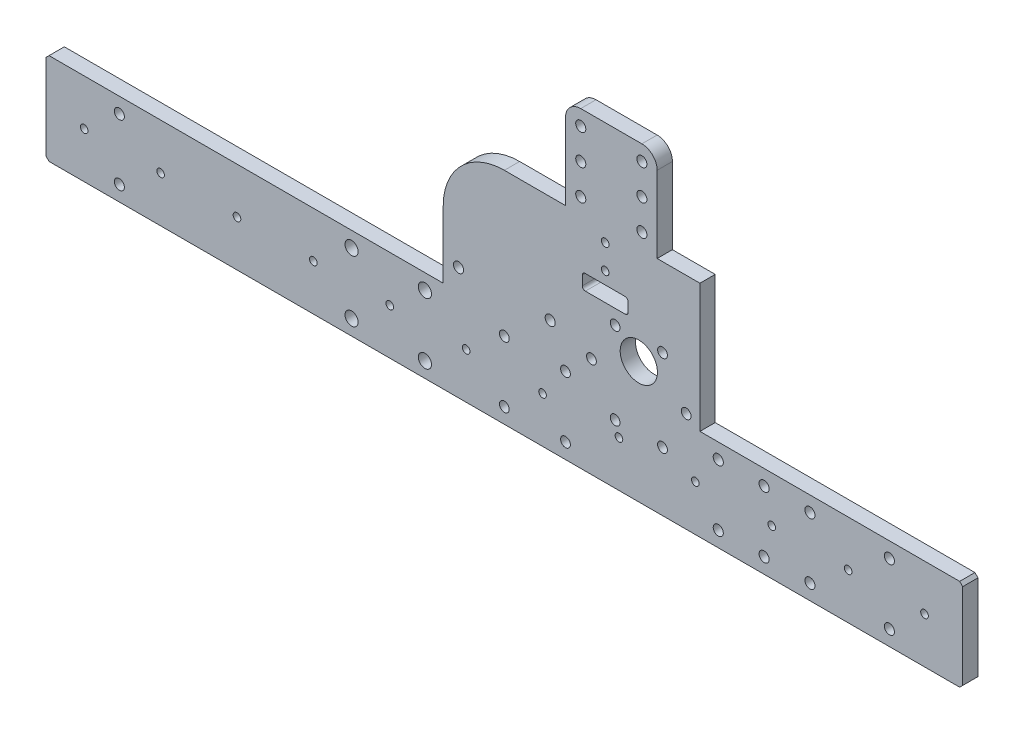
from build123d import *

# Parameters (mm, degrees)
SKETCH_1_W                  = 300
SKETCH_1_H                  = 30
EXTRUDE_1_DEPTH             = 5
CHAMFER_1_SIZE              = 1
HOLE_WIZARD_M3_1_D          = 3.2
M3X0_5_1_D                  = 2.5
M4X0_7_1_D                  = 3.3
M4X0_7_2_D                  = 3.3
PATTERN_LINEAR_1_COUNT      = 6
PATTERN_LINEAR_1_PITCH      = 25
PATTERN_LINEAR_1_COL_COUNT  = 7
PATTERN_LINEAR_1_COL_PITCH  = 25
EXTRUDE_3_DEPTH             = 5
SKETCH_13_R                 = 6.1
CUT_EXTRUDE_2_DEPTH         = 161.542829177
HOLE_WIZARD_M2_1_D          = 2.2
M4X0_7_3_D                  = 3.3
HOLE_WIZARD_M4_1_D          = 4.3
M3X0_5_2_D                  = 2.5
CUT_EXTRUDE_3_DEPTH         = 161.542829177
CUT_EXTRUDE_3_DEPTH_BACK    = 161.542829177
SKETCH_25_W                 = 15
SKETCH_25_H                 = 5
FILLET_1_R                  = 1
SKETCH_26_W                 = 30
SKETCH_26_H                 = 5
EXTRUDE_4_DEPTH             = 30
SKETCH_27_R                 = 1.65
CUT_EXTRUDE_4_DEPTH         = 174.476223155
PATTERN_LINEAR_2_COUNT      = 2
PATTERN_LINEAR_2_PITCH      = 20
PATTERN_LINEAR_2_COUNT_DIR2 = 3
PATTERN_LINEAR_2_PITCH_DIR2 = 10
FILLET_2_R                  = 5
HOLE_WIZARD_M3_2_D          = 3.2


with BuildPart() as part:
    # 草圖1 → 填料-伸長1 (new body)
    with BuildSketch(Plane.XY):
        Rectangle(SKETCH_1_W, SKETCH_1_H)
    extrude(amount=EXTRUDE_1_DEPTH)

    # 導角1
    chamfer_1_edges = [part.edges().sort_by_distance(p)[0] for p in [
        (150, -15, 2.5),
        (-150, -15, 2.5),
        (-150, 15, 2.5),
        (150, 15, 2.5),
    ]]
    chamfer(chamfer_1_edges, length=CHAMFER_1_SIZE)

    # M3 餘隙孔1 (through all)
    with Locations(Plane.XY.offset(5)):
        with Locations((20, -10), (20, 10), (0, -10), (0, 10)):
            Hole(HOLE_WIZARD_M3_1_D / 2)

    # M3x0.5 螺紋孔1 (through all)
    with Locations(Plane.XY.offset(5)):
        with Locations((-12.5, 0)):
            m3x0_5_1 = Hole(M3X0_5_1_D / 2)

    # M4x0.7 螺紋孔1 (through all)
    with Locations(Plane.XY.offset(5)):
        with Locations((100, 10), (70, -10), (70, 10), (100, -10), (85, 10), (85, -10)):
            Hole(M4X0_7_1_D / 2)

    # M4x0.7 螺紋孔2 (through all)
    with Locations(Plane.XY.offset(5)):
        with Locations((-126, 10), (-126, -10)):
            m4x0_7_2 = Hole(M4X0_7_2_D / 2)

    # 直線複製排列1: M3x0.5 螺紋孔1 ×6
    with Locations(*[(-i * PATTERN_LINEAR_1_PITCH, 0, 0) for i in range(1, PATTERN_LINEAR_1_COUNT)]):
        add(m3x0_5_1, mode=Mode.SUBTRACT)

    # 直線複製排列1 col: M3x0.5 螺紋孔1 ×7
    with Locations(*[(i * PATTERN_LINEAR_1_COL_PITCH, 0, 0) for i in range(1, PATTERN_LINEAR_1_COL_COUNT)]):
        add(m3x0_5_1, mode=Mode.SUBTRACT)

    # 鏡射1: M4x0.7 螺紋孔2 across plane
    add(m4x0_7_2.mirror(Plane(origin=(0, 0, 0), x_dir=(0, 0, 1), z_dir=(1, 0, 0))), mode=Mode.SUBTRACT)

    # 草圖16 → 填料-伸長3 (add, through all)
    with BuildSketch(Plane.XY):
        with BuildLine():
            Line((-20, 15), (64, 15))
            Line((64, 15), (64, 57))
            Line((64, 57), (0, 57))
            ThreePointArc((0, 57), (-14.142135624, 51.142135624), (-20, 37))
            Line((-20, 37), (-20, 15))
        make_face()
    extrude(amount=EXTRUDE_3_DEPTH)

    # 草圖13 → 除料-伸長2 (cut, through all)
    with BuildSketch(Plane.XY):
        with Locations(Location((44, 24.8, 0), (0, 0, 180))):
            Circle(SKETCH_13_R)
    extrude(amount=CUT_EXTRUDE_2_DEPTH, mode=Mode.SUBTRACT)

    # M2 餘隙孔1 (through all)
    with Locations(Plane.XY.offset(5)):
        with Locations((39, 24.8), (49, 24.8)):
            Hole(HOLE_WIZARD_M2_1_D / 2)

    # M4x0.7 螺紋孔3 (through all)
    with Locations(Plane.XY.offset(5)):
        with Locations((15, 22), (-15, 22)):
            Hole(M4X0_7_3_D / 2)

    # M4 餘隙孔1 (through all)
    with Locations(Plane.XY.offset(5)):
        with Locations((-26, -10), (-26, 10), (-50, -10), (-50, 10)):
            Hole(HOLE_WIZARD_M4_1_D / 2)

    # M3x0.5 螺紋孔2 (through all)
    with Locations(Plane.XY.offset(5)):
        with Locations((33, 53), (33, 45)):
            Hole(M3X0_5_2_D / 2)

    # 草圖25 → 除料-伸長3 (cut, two sides: drawn at the far end of the back side and taken through both)
    with BuildSketch(Plane.XY.offset(5).offset(-CUT_EXTRUDE_3_DEPTH_BACK)):
        with Locations((33, 38.5)):
            Rectangle(SKETCH_25_W, SKETCH_25_H)
    extrude(amount=CUT_EXTRUDE_3_DEPTH + CUT_EXTRUDE_3_DEPTH_BACK, mode=Mode.SUBTRACT)

    # 圓角1
    fillet_1_edges = [part.edges().sort_by_distance(p)[0] for p in [
        (40.5, 41, 2.5),
        (40.5, 36, 2.5),
        (25.5, 36, 2.5),
        (25.5, 41, 2.5),
    ]]
    fillet(fillet_1_edges, radius=FILLET_1_R)

    # 草圖26 → 填料-伸長4 (add)
    with BuildSketch(Plane(origin=(0, 57, 0), x_dir=(1, 0, 0), z_dir=(0, 1, 0))):
        with Locations((35, -2.5)):
            Rectangle(SKETCH_26_W, SKETCH_26_H)
    extrude(amount=EXTRUDE_4_DEPTH)

    # 草圖27 → 除料-伸長4 (cut, through all)
    with BuildSketch(Plane.XY.offset(5)):
        with Locations((25, 82)):
            Circle(SKETCH_27_R)
    cut_extrude_4 = extrude(amount=-CUT_EXTRUDE_4_DEPTH, mode=Mode.SUBTRACT)

    # 直線複製排列2: Cut-Extrude 4 2 × 3
    with Locations(*[(i * PATTERN_LINEAR_2_PITCH, -j * PATTERN_LINEAR_2_PITCH_DIR2, 0) for i in range(PATTERN_LINEAR_2_COUNT) for j in range(PATTERN_LINEAR_2_COUNT_DIR2) if (i, j) != (0, 0)]):
        add(cut_extrude_4, mode=Mode.SUBTRACT)

    # 圓角2
    fillet_2_edges = [part.edges().sort_by_distance(p)[0] for p in [
        (50, 87, 2.5),
        (20, 87, 2.5),
    ]]
    fillet(fillet_2_edges, radius=FILLET_2_R)

    # M3 餘隙孔2 (through all)
    with Locations(Plane.XY.offset(5)):
        with Locations((36.25, 4.376606241), (28.5, 17.8), (59.5, 17.8), (36.25, 31.223393759), (51.75, 4.376606241), (51.75, 31.223393759)):
            Hole(HOLE_WIZARD_M3_2_D / 2)


solid = part.part
